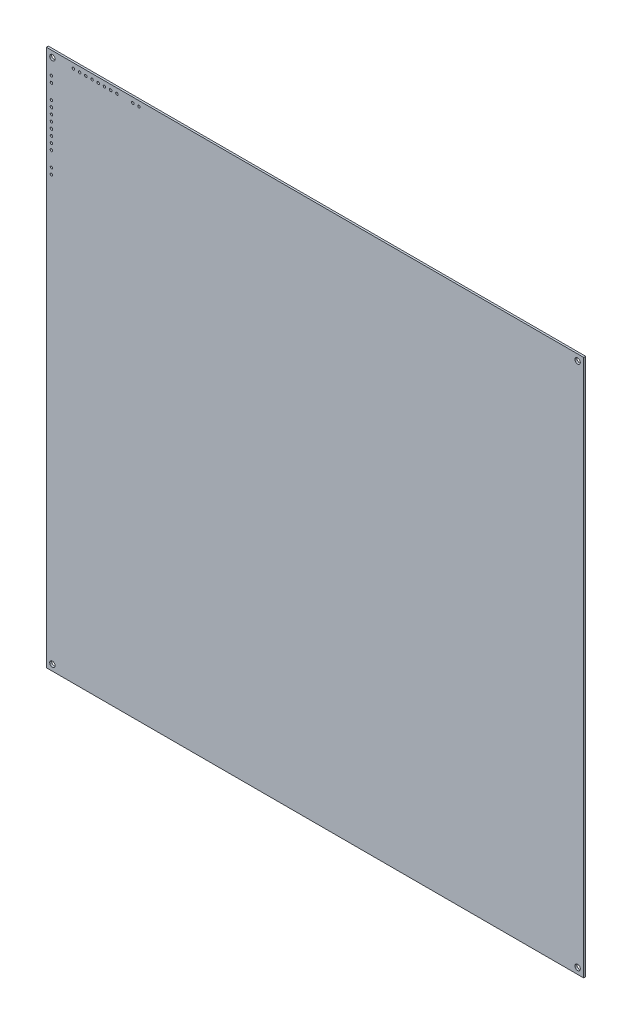
from build123d import *

# Parameters (mm, degrees)
SKETCH1_W           = 220
SKETCH1_H           = 220
SKETCH1_R           = 1.1
SKETCH1_R_2         = 0.5
BOSS_EXTRUDE1_DEPTH = 0.8


with BuildPart() as part:
    # Sketch1 → Boss-Extrude1 (new body)
    with BuildSketch(Plane.XY.offset(1.6)):
        with Locations((110, -110)):
            Rectangle(SKETCH1_W, SKETCH1_H)
        with Locations(Location((217.5, -217.5, 0), (0, 0, 180))):
            Circle(SKETCH1_R, mode=Mode.SUBTRACT)
        with Locations(Location((2.1, -44.14, 0), (0, 0, 180))):
            Circle(SKETCH1_R_2, mode=Mode.SUBTRACT)
        with Locations(Location((2.5, -217.5, 0), (0, 0, 180))):
            Circle(SKETCH1_R, mode=Mode.SUBTRACT)
        with Locations(Location((2.1, -11.6, 0), (0, 0, 180))):
            Circle(SKETCH1_R_2, mode=Mode.SUBTRACT)
        with Locations(Location((2.1, -9.06, 0), (0, 0, 180))):
            Circle(SKETCH1_R_2, mode=Mode.SUBTRACT)
        with Locations(Location((2.1, -17.72, 0), (0, 0, 180))):
            Circle(SKETCH1_R_2, mode=Mode.SUBTRACT)
        with Locations(Location((2.1, -20.26, 0), (0, 0, 180))):
            Circle(SKETCH1_R_2, mode=Mode.SUBTRACT)
        with Locations(Location((2.1, -27.88, 0), (0, 0, 180))):
            Circle(SKETCH1_R_2, mode=Mode.SUBTRACT)
        with Locations(Location((2.1, -30.42, 0), (0, 0, 180))):
            Circle(SKETCH1_R_2, mode=Mode.SUBTRACT)
        with Locations(Location((2.1, -25.34, 0), (0, 0, 180))):
            Circle(SKETCH1_R_2, mode=Mode.SUBTRACT)
        with Locations(Location((2.1, -22.8, 0), (0, 0, 180))):
            Circle(SKETCH1_R_2, mode=Mode.SUBTRACT)
        with Locations(Location((2.1, -32.96, 0), (0, 0, 180))):
            Circle(SKETCH1_R_2, mode=Mode.SUBTRACT)
        with Locations(Location((2.1, -35.5, 0), (0, 0, 180))):
            Circle(SKETCH1_R_2, mode=Mode.SUBTRACT)
        with Locations(Location((2.1, -41.6, 0), (0, 0, 180))):
            Circle(SKETCH1_R_2, mode=Mode.SUBTRACT)
        with Locations(Location((11.1, -2.1, 0), (0, 0, 180))):
            Circle(SKETCH1_R_2, mode=Mode.SUBTRACT)
        with Locations(Location((2.5, -2.5, 0), (0, 0, 180))):
            Circle(SKETCH1_R, mode=Mode.SUBTRACT)
        with Locations(Location((217.5, -2.5, 0), (0, 0, 180))):
            Circle(SKETCH1_R, mode=Mode.SUBTRACT)
        with Locations(Location((37.94, -2.1, 0), (0, 0, 180))):
            Circle(SKETCH1_R_2, mode=Mode.SUBTRACT)
        with Locations(Location((35.4, -2.1, 0), (0, 0, 180))):
            Circle(SKETCH1_R_2, mode=Mode.SUBTRACT)
        with Locations(Location((28.88, -2.1, 0), (0, 0, 180))):
            Circle(SKETCH1_R_2, mode=Mode.SUBTRACT)
        with Locations(Location((21.26, -2.1, 0), (0, 0, 180))):
            Circle(SKETCH1_R_2, mode=Mode.SUBTRACT)
        with Locations(Location((23.8, -2.1, 0), (0, 0, 180))):
            Circle(SKETCH1_R_2, mode=Mode.SUBTRACT)
        with Locations(Location((26.34, -2.1, 0), (0, 0, 180))):
            Circle(SKETCH1_R_2, mode=Mode.SUBTRACT)
        with Locations(Location((16.18, -2.1, 0), (0, 0, 180))):
            Circle(SKETCH1_R_2, mode=Mode.SUBTRACT)
        with Locations(Location((18.72, -2.1, 0), (0, 0, 180))):
            Circle(SKETCH1_R_2, mode=Mode.SUBTRACT)
        with Locations(Location((13.64, -2.1, 0), (0, 0, 180))):
            Circle(SKETCH1_R_2, mode=Mode.SUBTRACT)
    extrude(amount=-BOSS_EXTRUDE1_DEPTH)


solid = part.part
